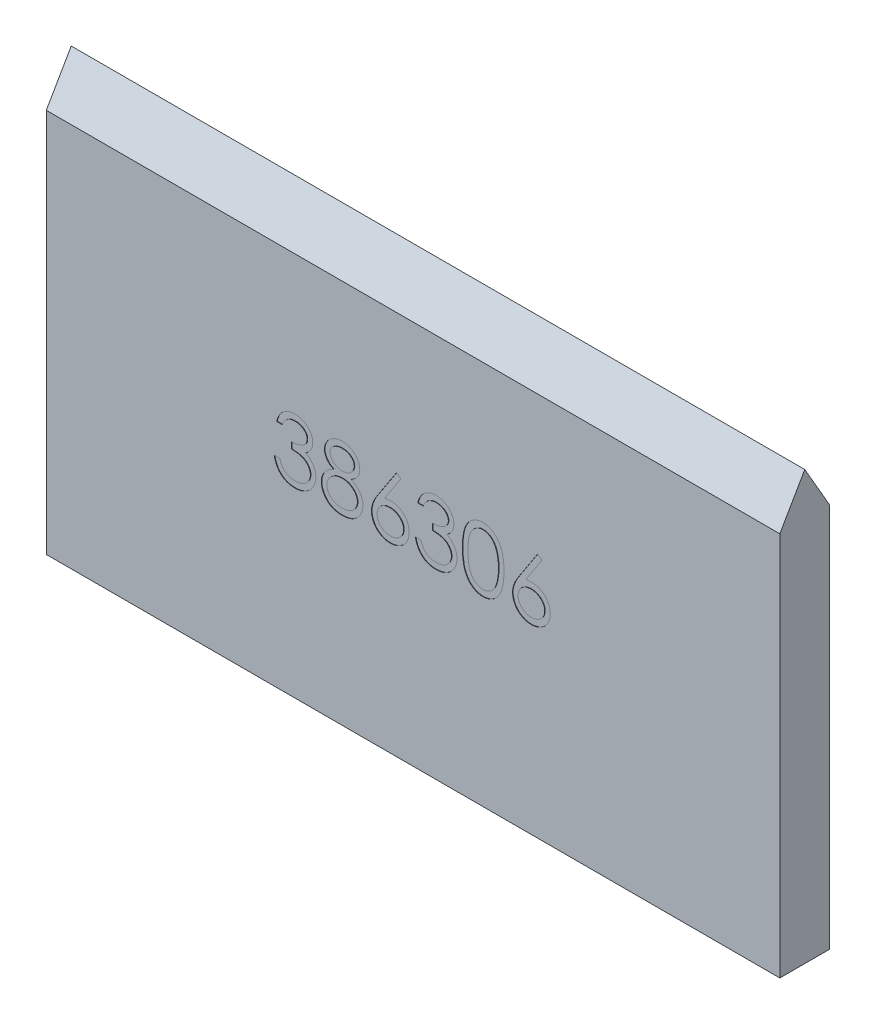
from build123d import *

# Parameters (mm, degrees)
CROQUIS1_W              = 38.1
CROQUIS1_H              = 22.225
SALIENTE_EXTRUIR1_DEPTH = 1.2954
CORTAR_EXTRUIR1_DEPTH   = 40.7086353
CORTAR_EXTRUIR2_DEPTH   = 0.0254


with BuildPart() as part:
    # Croquis1 → Saliente-Extruir1 (new, symmetric)
    with BuildSketch(Plane.XY):
        Rectangle(CROQUIS1_W, CROQUIS1_H)
    extrude(amount=SALIENTE_EXTRUIR1_DEPTH, both=True)

    # Croquis2 → Cortar-Extruir1 (cut, through all)
    with BuildSketch(Plane(origin=(19.05, 0, 0), x_dir=(0, 0, -1), z_dir=(1, 0, 0))):
        Polygon((-1.2954, 8.868801384), (0, 11.1125), (-1.2954, 11.1125), align=None)
    cortar_extruir1 = extrude(amount=-CORTAR_EXTRUIR1_DEPTH, mode=Mode.SUBTRACT)

    # Simetría1: Cortar-Extruir1 across plane
    add(cortar_extruir1.mirror(Plane.XY), mode=Mode.SUBTRACT)

    # Croquis3 → Cortar-Extruir2 (cut)
    # profile 1 of 6: a face of its own
    with BuildSketch(Plane.XY.offset(1.2954)):
        with BuildLine():
            Line((-6.79775641, 0.854807692), (-7.082692308, 0.854807692))
            add(Edge.make_bspline(
                [(-7.082692308, 0.854807692), (-7.07497293, 0.886768588), (-7.059882177, 0.949249526), (-7.028406521, 1.03851897), (-6.994117196, 1.122995307), (-6.952942794, 1.201096746), (-6.908031282, 1.274392893), (-6.85657567, 1.341221313), (-6.800949922, 1.403281646), (-6.739423003, 1.458357226), (-6.674899146, 1.50822988), (-6.60646917, 1.550752254), (-6.53550983, 1.587332021), (-6.461529488, 1.617467517), (-6.38430789, 1.640169242), (-6.30454316, 1.656640059), (-6.222026271, 1.667336284), (-6.166012385, 1.66838019), (-6.137570112, 1.668910256)],
                knots=[0, 0, 0, 0, 1.162005537, 2.271625781, 3.343758855, 4.383309926, 5.390229558, 6.379919256, 7.361854164, 8.333198761, 9.295911338, 10.242430842, 11.177959212, 12.116337295, 13.062827104, 14.020064771, 14.994644689, 16, 16, 16, 16], degree=3))
            add(Edge.make_bspline(
                [(-6.137570112, 1.668910256), (-6.096129339, 1.667659098), (-6.014151736, 1.665184071), (-5.893716686, 1.642583118), (-5.777578072, 1.606818891), (-5.667007112, 1.557403438), (-5.564301819, 1.496454947), (-5.472919707, 1.423915507), (-5.394099415, 1.341184712), (-5.327973801, 1.249805886), (-5.276198623, 1.15214696), (-5.23802027, 1.051635389), (-5.214777745, 0.9485096), (-5.211765526, 0.878879783), (-5.21025641, 0.843995393)],
                knots=[0, 0, 0, 0, 1.083050992, 2.142477498, 3.193116406, 4.255571735, 5.30263384, 6.308962982, 7.297363603, 8.282367274, 9.249857812, 10.179914175, 11.08814088, 12, 12, 12, 12], degree=3))
            add(Edge.make_bspline(
                [(-5.21025641, 0.843995393), (-5.211311954, 0.810424943), (-5.213377488, 0.744732783), (-5.230915921, 0.648828282), (-5.260430959, 0.558439116), (-5.301315673, 0.473184776), (-5.354239793, 0.393605814), (-5.418350025, 0.319523185), (-5.494098869, 0.250608306), (-5.551501905, 0.211129927), (-5.581054688, 0.190805288)],
                knots=[0, 0, 0, 0, 1.024540389, 2.004866551, 2.965041327, 3.920577974, 4.882998113, 5.874504559, 6.905732034, 8, 8, 8, 8], degree=3))
            add(Edge.make_bspline(
                [(-5.581054688, 0.190805288), (-5.547280167, 0.174496519), (-5.480363074, 0.142184128), (-5.38914938, 0.078814977), (-5.306347307, 0.005648148), (-5.260170362, -0.05144983), (-5.236969151, -0.080138221)],
                knots=[0, 0, 0, 0, 1.015518401, 2.012035669, 3.001164323, 4, 4, 4, 4], degree=3))
            add(Edge.make_bspline(
                [(-5.236969151, -0.080138221), (-5.221691647, -0.101054896), (-5.19138682, -0.14254572), (-5.1539803, -0.209253764), (-5.120044889, -0.276701186), (-5.093601476, -0.34669579), (-5.073123754, -0.41842631), (-5.058486068, -0.492015912), (-5.04939274, -0.567524689), (-5.048090489, -0.618608153), (-5.047435897, -0.644285857)],
                knots=[0, 0, 0, 0, 1.025084078, 2.033381695, 3.024893161, 4.013698104, 4.991890475, 5.976764909, 6.982997093, 8, 8, 8, 8], degree=3))
            add(Edge.make_bspline(
                [(-5.047435897, -0.644285857), (-5.049063778, -0.688744676), (-5.052311877, -0.777453089), (-5.081344144, -0.908512301), (-5.126350441, -1.036624006), (-5.190264947, -1.159156182), (-5.268159045, -1.273801242), (-5.360830332, -1.376377608), (-5.467225859, -1.464550628), (-5.585885269, -1.538219906), (-5.71444295, -1.597109735), (-5.851943666, -1.637983273), (-5.996406215, -1.664604287), (-6.095472835, -1.667458946), (-6.145838341, -1.668910256)],
                knots=[0, 0, 0, 0, 0.955779014, 1.907060117, 2.875433937, 3.871313158, 4.872415639, 5.851225146, 6.836215519, 7.83643374, 8.849228613, 9.86973379, 10.916971861, 12, 12, 12, 12], degree=3))
            add(Edge.make_bspline(
                [(-6.145838341, -1.668910256), (-6.179782992, -1.668122663), (-6.246574746, -1.666572942), (-6.344767063, -1.655978782), (-6.438494604, -1.63662942), (-6.527884097, -1.610591422), (-6.613014951, -1.577578913), (-6.693627389, -1.53646838), (-6.770217364, -1.488107231), (-6.842062127, -1.431924619), (-6.909153113, -1.369076547), (-6.96970737, -1.298447302), (-7.024734468, -1.221342514), (-7.072761005, -1.136866599), (-7.115974526, -1.046111259), (-7.151517251, -0.947914407), (-7.182800588, -0.843153901), (-7.197345231, -0.770149094), (-7.204807692, -0.732692308)],
                knots=[0, 0, 0, 0, 1.048658725, 2.063410685, 3.046034179, 4.001477787, 4.936774919, 5.862367409, 6.792675028, 7.730719943, 8.675894397, 9.627829632, 10.600096036, 11.597688215, 12.626045268, 13.701542398, 14.82072376, 16, 16, 16, 16], degree=3))
            Line((-7.204807692, -0.732692308), (-6.919871795, -0.732692308))
            add(Edge.make_bspline(
                [(-6.919871795, -0.732692308), (-6.91244838, -0.757138913), (-6.898009195, -0.804689683), (-6.873430796, -0.873124817), (-6.845428863, -0.935861051), (-6.815389228, -0.993358597), (-6.783840209, -1.046183705), (-6.748538813, -1.092939544), (-6.71209966, -1.135679763), (-6.68463196, -1.159759518), (-6.671188902, -1.171544471)],
                knots=[0, 0, 0, 0, 1.198163088, 2.33053128, 3.407730985, 4.417276592, 5.372219308, 6.28897303, 7.162600585, 8, 8, 8, 8], degree=3))
            add(Edge.make_bspline(
                [(-6.671188902, -1.171544471), (-6.653412008, -1.185249888), (-6.617913092, -1.212618417), (-6.560066197, -1.247544894), (-6.499228764, -1.27780811), (-6.434082596, -1.300925463), (-6.366033483, -1.320499484), (-6.293981515, -1.333308812), (-6.218562369, -1.342097367), (-6.167065897, -1.342872912), (-6.1407502, -1.343269231)],
                knots=[0, 0, 0, 0, 0.946170439, 1.889420265, 2.845303464, 3.807233317, 4.801018734, 5.828864929, 6.890507805, 8, 8, 8, 8], degree=3))
            add(Edge.make_bspline(
                [(-6.1407502, -1.343269231), (-6.111038094, -1.342710517), (-6.052938636, -1.341618), (-5.968161728, -1.331570751), (-5.887509972, -1.316938162), (-5.811878818, -1.294338528), (-5.740277572, -1.266415898), (-5.673709933, -1.231356273), (-5.611302036, -1.190222133), (-5.553853218, -1.143468753), (-5.502195508, -1.092286397), (-5.456711807, -1.038753111), (-5.41804515, -0.983094608), (-5.386854332, -0.925002884), (-5.362224904, -0.864718498), (-5.345458001, -0.802072274), (-5.333799841, -0.737576897), (-5.332850414, -0.693735618), (-5.332371795, -0.671634615)],
                knots=[0, 0, 0, 0, 1.217147791, 2.380027433, 3.494444702, 4.572153297, 5.609568379, 6.639424714, 7.649109417, 8.668170816, 9.669597737, 10.625200337, 11.543417969, 12.441394052, 13.322311151, 14.205496177, 15.095365482, 16, 16, 16, 16], degree=3))
            add(Edge.make_bspline(
                [(-5.332371795, -0.671634615), (-5.333759997, -0.642051472), (-5.336529494, -0.583032388), (-5.357673705, -0.496202874), (-5.392452532, -0.412543064), (-5.441141167, -0.333480312), (-5.500410007, -0.260205029), (-5.569683886, -0.194825899), (-5.649538065, -0.140878031), (-5.723034661, -0.103604749), (-5.78813591, -0.078171117), (-5.843848437, -0.061230256), (-5.906220499, -0.046885012), (-5.974497829, -0.03353888), (-6.04919489, -0.022180228), (-6.130230359, -0.012708009), (-6.217620657, -0.005128794), (-6.278119071, -0.001744157), (-6.309294872, 0)],
                knots=[0, 0, 0, 0, 1.07054697, 2.135767047, 3.216561865, 4.33974944, 5.486079747, 6.621378074, 7.775625952, 8.963672916, 9.598146892, 10.304877434, 11.070270905, 11.915000392, 12.823868403, 13.805723172, 14.86925407, 16, 16, 16, 16], degree=3))
            Line((-6.309294872, 0), (-6.309294872, 0.325641026))
            add(Edge.make_bspline(
                [(-6.309294872, 0.325641026), (-6.270014529, 0.326307598), (-6.193073986, 0.327613248), (-6.080684152, 0.343404801), (-5.973211933, 0.36524937), (-5.873039103, 0.398709509), (-5.781736342, 0.437571778), (-5.702524988, 0.482794854), (-5.63651479, 0.533063948), (-5.584026533, 0.589154958), (-5.544539304, 0.64931218), (-5.515667852, 0.712010862), (-5.49861327, 0.777800546), (-5.496336644, 0.82269928), (-5.495192308, 0.845267428)],
                knots=[0, 0, 0, 0, 1.321986639, 2.589447074, 3.816329219, 5.01088745, 6.139805852, 7.153945165, 8.075214402, 8.924034688, 9.728124013, 10.488707548, 11.240355623, 12, 12, 12, 12], degree=3))
            add(Edge.make_bspline(
                [(-5.495192308, 0.845267428), (-5.495568238, 0.861847954), (-5.496316132, 0.894834124), (-5.505747949, 0.94302615), (-5.519921186, 0.989744866), (-5.539406369, 1.034791594), (-5.565486906, 1.077853913), (-5.596698051, 1.119298956), (-5.633861971, 1.158890099), (-5.676448198, 1.19579296), (-5.722178906, 1.230962197), (-5.772298345, 1.260819567), (-5.825295332, 1.286351159), (-5.88122854, 1.307405493), (-5.940279485, 1.323243562), (-6.00217072, 1.334615361), (-6.067020261, 1.341725234), (-6.11126319, 1.342748868), (-6.133754006, 1.343269231)],
                knots=[0, 0, 0, 0, 0.884392785, 1.759457502, 2.611959086, 3.489218968, 4.37281399, 5.2945488, 6.255912374, 7.266815255, 8.301784654, 9.332968512, 10.37626691, 11.440494194, 12.520033166, 13.637162961, 14.798855837, 16, 16, 16, 16], degree=3))
            add(Edge.make_bspline(
                [(-6.133754006, 1.343269231), (-6.169905162, 1.342007067), (-6.240516778, 1.339541767), (-6.342311738, 1.317949033), (-6.436944277, 1.283497486), (-6.509278639, 1.242373961), (-6.562693546, 1.201778925), (-6.600863339, 1.166325617), (-6.638346945, 1.126925841), (-6.672678381, 1.081152887), (-6.707398345, 1.032106584), (-6.73900734, 0.977293673), (-6.769722918, 0.918143972), (-6.788230946, 0.876328647), (-6.79775641, 0.854807692)],
                knots=[0, 0, 0, 0, 1.472543308, 2.876219568, 4.221790263, 5.565193594, 6.249813518, 6.953379497, 7.687249741, 8.463570142, 9.283606569, 10.136032583, 11.040678096, 12, 12, 12, 12], degree=3))
        make_face()
    # profile 2 of 6: a face of its own
    with BuildSketch(Plane.XY.offset(1.2954)):
        with BuildLine():
            add(Edge.make_bspline(
                [(-3.218885216, 0.181265024), (-3.192896891, 0.167714164), (-3.142210979, 0.141285461), (-3.070023083, 0.098730639), (-3.004051117, 0.053880621), (-2.942464679, 0.008853806), (-2.886345782, -0.038074192), (-2.836321922, -0.087089984), (-2.791157438, -0.136970092), (-2.751763141, -0.188559161), (-2.717113154, -0.241720135), (-2.687166431, -0.296592547), (-2.661569397, -0.353056143), (-2.641283017, -0.411727267), (-2.62457182, -0.471744076), (-2.613073236, -0.533881531), (-2.606889317, -0.597730183), (-2.605720179, -0.640881428), (-2.605128205, -0.662730369)],
                knots=[0, 0, 0, 0, 1.272397273, 2.481599622, 3.635517121, 4.734568067, 5.792894095, 6.808321871, 7.773003508, 8.711915296, 9.623354172, 10.525449501, 11.423591555, 12.311487226, 13.218079475, 14.126165749, 15.051214107, 16, 16, 16, 16], degree=3))
            add(Edge.make_bspline(
                [(-2.605128205, -0.662730369), (-2.605827994, -0.693299026), (-2.607213138, -0.753805869), (-2.619278124, -0.843110556), (-2.63734204, -0.929844101), (-2.663721312, -1.013987489), (-2.697932745, -1.095076421), (-2.740093875, -1.173180308), (-2.787819753, -1.249579253), (-2.82614857, -1.296586853), (-2.845542869, -1.320372596)],
                knots=[0, 0, 0, 0, 1.025265484, 2.029385089, 3.018602448, 3.995076438, 4.983346944, 5.966715145, 6.97116228, 8, 8, 8, 8], degree=3))
            add(Edge.make_bspline(
                [(-2.845542869, -1.320372596), (-2.870794527, -1.34812552), (-2.920985803, -1.403288417), (-3.006967459, -1.47490808), (-3.101330168, -1.535096459), (-3.203708798, -1.584147392), (-3.313829683, -1.622325278), (-3.431669359, -1.649759562), (-3.557457555, -1.66547348), (-3.643913232, -1.667744957), (-3.688266226, -1.668910256)],
                knots=[0, 0, 0, 0, 0.954267603, 1.896743057, 2.838368354, 3.796610408, 4.779680527, 5.799409237, 6.871065594, 8, 8, 8, 8], degree=3))
            add(Edge.make_bspline(
                [(-3.688266226, -1.668910256), (-3.730914086, -1.667864794), (-3.813902489, -1.665830431), (-3.934695706, -1.652046911), (-4.047293062, -1.627891632), (-4.152349248, -1.594831165), (-4.24923092, -1.551823315), (-4.337662019, -1.498294258), (-4.418918408, -1.436398593), (-4.490534137, -1.364358679), (-4.554114369, -1.287199038), (-4.609965388, -1.207595792), (-4.656387588, -1.125541675), (-4.695691453, -1.042260185), (-4.725779588, -0.95658403), (-4.746618664, -0.868954019), (-4.759853256, -0.77952321), (-4.761614143, -0.719169496), (-4.7625, -0.688807091)],
                knots=[0, 0, 0, 0, 1.256902934, 2.445805442, 3.576955095, 4.645999104, 5.686449165, 6.692658513, 7.68621702, 8.689161843, 9.678783111, 10.630372946, 11.551080876, 12.453998257, 13.34127905, 14.221779781, 15.105423033, 16, 16, 16, 16], degree=3))
            add(Edge.make_bspline(
                [(-4.7625, -0.688807091), (-4.761975779, -0.666528396), (-4.760939734, -0.62249783), (-4.753768908, -0.557447225), (-4.742240518, -0.49413216), (-4.726583725, -0.432318771), (-4.705364722, -0.372457073), (-4.679745073, -0.314263429), (-4.649871087, -0.25767214), (-4.615326031, -0.202373726), (-4.575137766, -0.149143026), (-4.529632169, -0.097076659), (-4.477899746, -0.046982537), (-4.420516012, 0.001751377), (-4.358136751, 0.049989582), (-4.289141706, 0.095125136), (-4.215359906, 0.140353432), (-4.162922145, 0.167393842), (-4.136022636, 0.181265024)],
                knots=[0, 0, 0, 0, 0.941657376, 1.861047343, 2.762797495, 3.66048619, 4.553285746, 5.444104102, 6.34607688, 7.256116206, 8.197091036, 9.162375105, 10.176350973, 11.237807142, 12.343728897, 13.50695164, 14.721116704, 16, 16, 16, 16], degree=3))
            add(Edge.make_bspline(
                [(-4.136022636, 0.181265024), (-4.172844812, 0.201344421), (-4.24414285, 0.240223755), (-4.3385487, 0.311658357), (-4.419638766, 0.389026589), (-4.485184117, 0.473962189), (-4.536775352, 0.563811853), (-4.572170801, 0.658013425), (-4.596116183, 0.754820185), (-4.598488205, 0.820956521), (-4.599679487, 0.854171675)],
                knots=[0, 0, 0, 0, 1.166880483, 2.259407225, 3.286803203, 4.280235371, 5.237608625, 6.161067461, 7.076446754, 8, 8, 8, 8], degree=3))
            add(Edge.make_bspline(
                [(-4.599679487, 0.854171675), (-4.598195924, 0.888005888), (-4.595213703, 0.956018558), (-4.571098834, 1.057261256), (-4.531801345, 1.15669914), (-4.478351583, 1.253850251), (-4.411778894, 1.345426517), (-4.331908099, 1.42756009), (-4.240646537, 1.499506935), (-4.138449758, 1.559901034), (-4.028471172, 1.609053353), (-3.912433337, 1.642960922), (-3.792358018, 1.665127971), (-3.710626516, 1.667637722), (-3.669185697, 1.668910256)],
                knots=[0, 0, 0, 0, 0.888701115, 1.786444228, 2.72001202, 3.692817113, 4.693886446, 5.687152267, 6.695133018, 7.739871481, 8.800368666, 9.853104506, 10.91144658, 12, 12, 12, 12], degree=3))
            add(Edge.make_bspline(
                [(-3.669185697, 1.668910256), (-3.628814379, 1.667598217), (-3.54920674, 1.665011024), (-3.432190185, 1.643432927), (-3.320226189, 1.607392577), (-3.213700857, 1.558500096), (-3.114521235, 1.498277657), (-3.02688914, 1.425342578), (-2.949480298, 1.343571314), (-2.885450169, 1.252022817), (-2.832688119, 1.155245013), (-2.795948016, 1.05398744), (-2.772405868, 0.950437937), (-2.769436459, 0.880372033), (-2.767948718, 0.845267428)],
                knots=[0, 0, 0, 0, 1.072916533, 2.115669174, 3.151510826, 4.193348718, 5.225979165, 6.227137561, 7.216255879, 8.211077061, 9.189680878, 10.138522389, 11.067357538, 12, 12, 12, 12], degree=3))
            add(Edge.make_bspline(
                [(-2.767948718, 0.845267428), (-2.769250069, 0.810817169), (-2.77180585, 0.743158817), (-2.79330508, 0.644528331), (-2.829512158, 0.552161195), (-2.878946149, 0.465009303), (-2.943376412, 0.38465323), (-3.021942906, 0.310071147), (-3.114019247, 0.240650381), (-3.183198765, 0.201474179), (-3.218885216, 0.181265024)],
                knots=[0, 0, 0, 0, 0.975232327, 1.915300861, 2.843280834, 3.77672583, 4.742871857, 5.749627742, 6.839139064, 8, 8, 8, 8], degree=3))
        make_face()
        with BuildLine():
            add(Edge.make_bspline(
                [(-3.685086138, 1.343269231), (-3.707357226, 1.342678281), (-3.750929213, 1.341522125), (-3.814818078, 1.33548179), (-3.875571583, 1.323731372), (-3.933824488, 1.308093398), (-3.988778125, 1.286967866), (-4.041178828, 1.262116679), (-4.090134779, 1.23190332), (-4.136236961, 1.198011376), (-4.177739449, 1.16073424), (-4.214573578, 1.12189608), (-4.245169796, 1.080734118), (-4.271151374, 1.038272248), (-4.290003179, 0.993250226), (-4.304122226, 0.947048373), (-4.313666631, 0.899082846), (-4.314381813, 0.866301868), (-4.31474359, 0.849719551)],
                knots=[0, 0, 0, 0, 1.203892937, 2.355340988, 3.463153438, 4.544400666, 5.610487187, 6.640501085, 7.674077295, 8.714426146, 9.728707835, 10.68524104, 11.601827946, 12.495867327, 13.368432065, 14.231010473, 15.105153427, 16, 16, 16, 16], degree=3))
            add(Edge.make_bspline(
                [(-4.31474359, 0.849719551), (-4.31412005, 0.833136518), (-4.312887845, 0.800366061), (-4.303358193, 0.75197374), (-4.289155189, 0.704419826), (-4.266793518, 0.658835071), (-4.239972607, 0.613638167), (-4.206869625, 0.569958707), (-4.167418864, 0.527644679), (-4.122943972, 0.487055986), (-4.074492077, 0.449047822), (-4.023162266, 0.41605215), (-3.969598754, 0.388444064), (-3.914351877, 0.365466676), (-3.856858571, 0.34760509), (-3.797471127, 0.334933532), (-3.736179565, 0.327057721), (-3.694650038, 0.326116994), (-3.673637821, 0.325641026)],
                knots=[0, 0, 0, 0, 0.873023192, 1.725219244, 2.590779336, 3.480155217, 4.391973325, 5.357036234, 6.360879153, 7.436073238, 8.526419356, 9.601555421, 10.645666583, 11.697338044, 12.750135903, 13.812665442, 14.89329948, 16, 16, 16, 16], degree=3))
            add(Edge.make_bspline(
                [(-3.673637821, 0.325641026), (-3.646650226, 0.326432841), (-3.592941593, 0.328008651), (-3.513766771, 0.342660072), (-3.436784229, 0.365706869), (-3.362816794, 0.397239124), (-3.293779063, 0.436815826), (-3.23223843, 0.484198635), (-3.17871982, 0.538293466), (-3.133779409, 0.598258181), (-3.098936192, 0.662077122), (-3.07181098, 0.726121673), (-3.055971163, 0.791075126), (-3.053905085, 0.834588014), (-3.052884615, 0.856079728)],
                knots=[0, 0, 0, 0, 1.076279235, 2.141928126, 3.20205304, 4.278698113, 5.344010996, 6.36967002, 7.368914609, 8.37248503, 9.349703398, 10.264243087, 11.142681841, 12, 12, 12, 12], degree=3))
            add(Edge.make_bspline(
                [(-3.052884615, 0.856079728), (-3.053367122, 0.871163732), (-3.05432483, 0.901103317), (-3.062217024, 0.945315977), (-3.075257958, 0.988522814), (-3.092913752, 1.03108076), (-3.116145494, 1.072392709), (-3.14369015, 1.113108082), (-3.177149662, 1.152310953), (-3.214702141, 1.190914915), (-3.257288333, 1.226641851), (-3.304826168, 1.258060481), (-3.357071927, 1.28474169), (-3.414026846, 1.306412204), (-3.47548117, 1.322688478), (-3.541151849, 1.334877165), (-3.611586454, 1.341747059), (-3.660054871, 1.342750835), (-3.685086138, 1.343269231)],
                knots=[0, 0, 0, 0, 0.814439003, 1.616544685, 2.417341072, 3.248991801, 4.09997495, 4.973547432, 5.9003056, 6.880240646, 7.880314356, 8.896779544, 9.951930927, 11.043077905, 12.18215768, 13.381699519, 14.647792085, 16, 16, 16, 16], degree=3))
        make_face(mode=Mode.SUBTRACT)
        with BuildLine():
            add(Edge.make_bspline(
                [(-3.666641627, 0), (-3.694877161, -0.000502232), (-3.750268389, -0.001487488), (-3.831418602, -0.012454392), (-3.909299688, -0.027721056), (-3.983649059, -0.050881174), (-4.054435318, -0.080995133), (-4.122041666, -0.117221465), (-4.185950905, -0.160043546), (-4.245280521, -0.208917333), (-4.299458113, -0.261585552), (-4.346990856, -0.317340489), (-4.387356464, -0.375145929), (-4.419862342, -0.435736023), (-4.446542984, -0.497827784), (-4.46406343, -0.562967531), (-4.475295411, -0.629902984), (-4.476803656, -0.675405359), (-4.477564103, -0.698347356)],
                knots=[0, 0, 0, 0, 1.140299081, 2.23698856, 3.303958914, 4.344563908, 5.37730929, 6.408454204, 7.439741482, 8.480804886, 9.510774543, 10.48932336, 11.43758569, 12.353841022, 13.263987381, 14.161954604, 15.073269652, 16, 16, 16, 16], degree=3))
            add(Edge.make_bspline(
                [(-4.477564103, -0.698347356), (-4.476327432, -0.726859678), (-4.473873907, -0.783427458), (-4.45440967, -0.86703253), (-4.42317172, -0.947968773), (-4.379605988, -1.025576616), (-4.325660405, -1.098102783), (-4.259324252, -1.161320458), (-4.184720063, -1.217492085), (-4.099323581, -1.262922284), (-4.006043473, -1.299203331), (-3.904904547, -1.324200525), (-3.7973583, -1.340748126), (-3.723099955, -1.342415619), (-3.685086138, -1.343269231)],
                knots=[0, 0, 0, 0, 0.898778495, 1.783155532, 2.693654817, 3.627872908, 4.583023416, 5.533784346, 6.509005473, 7.520592997, 8.575161974, 9.658835044, 10.801527049, 12, 12, 12, 12], degree=3))
            add(Edge.make_bspline(
                [(-3.685086138, -1.343269231), (-3.655376875, -1.342698812), (-3.597493705, -1.341587452), (-3.513051452, -1.331777343), (-3.433363897, -1.316220183), (-3.358585573, -1.293592824), (-3.287879375, -1.265970345), (-3.222444118, -1.230435671), (-3.160596454, -1.190020349), (-3.105384, -1.14207045), (-3.055098161, -1.09083548), (-3.01125296, -1.036597369), (-2.973191467, -0.980830189), (-2.943318386, -0.922273678), (-2.919436713, -0.862051262), (-2.902270345, -0.79960762), (-2.89167835, -0.73475123), (-2.890607109, -0.690755644), (-2.890064103, -0.668454527)],
                knots=[0, 0, 0, 0, 1.224942928, 2.386581632, 3.501229538, 4.569074225, 5.605009692, 6.626002462, 7.634866581, 8.645888296, 9.63523824, 10.59253846, 11.518950513, 12.414518923, 13.29783783, 14.186679152, 15.080837789, 16, 16, 16, 16], degree=3))
            add(Edge.make_bspline(
                [(-2.890064103, -0.668454527), (-2.890885837, -0.646794368), (-2.892506153, -0.604084318), (-2.902790151, -0.540796112), (-2.920856697, -0.479652131), (-2.94564655, -0.419916768), (-2.97864928, -0.362800377), (-3.017515698, -0.306814993), (-3.064409648, -0.253514504), (-3.117398218, -0.20248491), (-3.175145989, -0.155299206), (-3.236529756, -0.113557537), (-3.301077018, -0.078403831), (-3.368651188, -0.049813867), (-3.439102221, -0.027328091), (-3.512378299, -0.01162001), (-3.588565213, -0.001732513), (-3.640322132, -0.000584029), (-3.666641627, 0)],
                knots=[0, 0, 0, 0, 0.917430815, 1.809013306, 2.70690318, 3.612392954, 4.541220862, 5.495268465, 6.494511384, 7.542276156, 8.608045339, 9.649016899, 10.681629292, 11.715607085, 12.752076957, 13.808767841, 14.885711793, 16, 16, 16, 16], degree=3))
        make_face(mode=Mode.SUBTRACT)
    # profile 3 of 6: a face of its own
    with BuildSketch(Plane.XY.offset(1.2954)):
        with BuildLine():
            Line((-0.854807692, 1.668910256), (-0.635381611, 1.496549479))
            Line((-0.635381611, 1.496549479), (-1.474288862, 0.213701923))
            add(Edge.make_bspline(
                [(-1.474288862, 0.213701923), (-1.418435825, 0.222604497), (-1.309488161, 0.239969973), (-1.199210525, 0.242834681), (-1.145467748, 0.244230769)],
                knots=[0, 0, 0, 0, 1.025318673, 2, 2, 2, 2], degree=3))
            add(Edge.make_bspline(
                [(-1.145467748, 0.244230769), (-1.113198412, 0.243363439), (-1.049677185, 0.241656126), (-0.956416729, 0.228517205), (-0.866801051, 0.207811567), (-0.781201588, 0.177628878), (-0.699311098, 0.139073171), (-0.620659638, 0.092864338), (-0.546725672, 0.036616328), (-0.476557102, -0.026216881), (-0.412851093, -0.095810146), (-0.356448528, -0.169652787), (-0.309071367, -0.247667872), (-0.270632167, -0.329815886), (-0.240782741, -0.4159702), (-0.21902252, -0.506020584), (-0.206159604, -0.600029133), (-0.204412909, -0.663962906), (-0.203525641, -0.696439303)],
                knots=[0, 0, 0, 0, 1.04369286, 2.054478336, 3.041073146, 4.015093852, 4.984733326, 5.965804835, 6.960378782, 7.985147595, 9.009457201, 10.008161701, 10.986880575, 11.956520048, 12.937015923, 13.931873656, 14.949455224, 16, 16, 16, 16], degree=3))
            add(Edge.make_bspline(
                [(-0.203525641, -0.696439303), (-0.2048166, -0.740870891), (-0.207356903, -0.828301743), (-0.232669632, -0.955643469), (-0.272003024, -1.076957965), (-0.328225497, -1.190308342), (-0.398059515, -1.295539245), (-0.483219903, -1.388780346), (-0.580686496, -1.471938165), (-0.690892377, -1.54147667), (-0.809494923, -1.59826658), (-0.934092807, -1.639056478), (-1.063476004, -1.66416934), (-1.151291612, -1.667317672), (-1.195713141, -1.668910256)],
                knots=[0, 0, 0, 0, 1.031375318, 2.029502543, 3.004789286, 3.987476834, 4.960371455, 5.9300674, 6.912260825, 7.929083631, 8.949397511, 9.960523116, 10.96833055, 12, 12, 12, 12], degree=3))
            add(Edge.make_bspline(
                [(-1.195713141, -1.668910256), (-1.238436577, -1.667523955), (-1.323064222, -1.664777936), (-1.447553971, -1.640315978), (-1.567172566, -1.600667392), (-1.681081933, -1.546044439), (-1.786601346, -1.477049074), (-1.881003744, -1.393989007), (-1.963818426, -1.298639706), (-2.03273826, -1.191015963), (-2.087401539, -1.075364358), (-2.128395256, -0.954771366), (-2.15234042, -0.829676383), (-2.155686468, -0.744875635), (-2.157371795, -0.702163462)],
                knots=[0, 0, 0, 0, 1.012016664, 2.004627821, 2.994792927, 3.992885782, 4.990978636, 5.973936114, 6.964471063, 7.975201453, 8.993600317, 9.990122807, 10.98767138, 12, 12, 12, 12], degree=3))
            add(Edge.make_bspline(
                [(-2.157371795, -0.702163462), (-2.156300055, -0.669465875), (-2.154111768, -0.602703652), (-2.138832407, -0.501589855), (-2.114280772, -0.398129231), (-2.086785048, -0.310359355), (-2.057733245, -0.238457832), (-2.033555584, -0.180488237), (-2.003462031, -0.120833549), (-1.97137332, -0.057448179), (-1.934401018, 0.008034321), (-1.894200393, 0.076708364), (-1.849659996, 0.147481769), (-1.818435991, 0.195509718), (-1.802473958, 0.220062099)],
                knots=[0, 0, 0, 0, 1.173818275, 2.396712641, 3.66331629, 4.989737886, 5.693666774, 6.447286557, 7.243889047, 8.091586357, 8.998013824, 9.943181721, 10.948533338, 12, 12, 12, 12], degree=3))
            Line((-1.802473958, 0.220062099), (-0.854807692, 1.668910256))
        make_face()
        with BuildLine():
            add(Edge.make_bspline(
                [(-1.205253405, -0.081410256), (-1.22943987, -0.082116053), (-1.276683063, -0.083494679), (-1.345995503, -0.091500444), (-1.411593953, -0.10657631), (-1.474347495, -0.125777197), (-1.533082911, -0.15217783), (-1.588227073, -0.184246962), (-1.639993227, -0.222003316), (-1.687839164, -0.264912), (-1.73121843, -0.311891144), (-1.768575598, -0.362209925), (-1.80079949, -0.414655666), (-1.826999426, -0.469666571), (-1.847401137, -0.52722161), (-1.862158765, -0.587056072), (-1.87037181, -0.649571192), (-1.871738178, -0.691964248), (-1.872435897, -0.713611779)],
                knots=[0, 0, 0, 0, 1.129588631, 2.206414736, 3.251139165, 4.268635594, 5.265702196, 6.250456724, 7.242448911, 8.251968645, 9.246821453, 10.222880186, 11.173611482, 12.116736599, 13.062300278, 14.020270554, 14.989073742, 16, 16, 16, 16], degree=3))
            add(Edge.make_bspline(
                [(-1.872435897, -0.713611779), (-1.871867698, -0.735065689), (-1.870753544, -0.777133613), (-1.860636796, -0.839127012), (-1.845183543, -0.898785179), (-1.822196184, -0.955800558), (-1.794776078, -1.011042218), (-1.758576249, -1.062509227), (-1.718465307, -1.113327433), (-1.670519239, -1.159593054), (-1.619063045, -1.202642991), (-1.564089097, -1.240271507), (-1.506793991, -1.272462536), (-1.446404201, -1.297691174), (-1.383776524, -1.318396063), (-1.318389164, -1.332966119), (-1.250196645, -1.341203454), (-1.204003173, -1.342571601), (-1.180448718, -1.343269231)],
                knots=[0, 0, 0, 0, 0.989467248, 1.94019797, 2.891935182, 3.827694429, 4.772920941, 5.730924762, 6.725747692, 7.756678648, 8.79901574, 9.819492441, 10.826891316, 11.826466727, 12.835195252, 13.867842842, 14.912794438, 16, 16, 16, 16], degree=3))
            add(Edge.make_bspline(
                [(-1.180448718, -1.343269231), (-1.156894301, -1.342571546), (-1.110700905, -1.341203292), (-1.042507837, -1.332966735), (-0.977122505, -1.318393804), (-0.914487458, -1.297699363), (-0.854124874, -1.27243216), (-0.796879877, -1.240471775), (-0.742425821, -1.202411583), (-0.690935848, -1.159666623), (-0.643189347, -1.113064107), (-0.602116387, -1.062962859), (-0.567025168, -1.010626254), (-0.53850987, -0.956018168), (-0.515775699, -0.898750704), (-0.500244082, -0.839136248), (-0.490148227, -0.777131196), (-0.489031202, -0.735064873), (-0.488461538, -0.713611779)],
                knots=[0, 0, 0, 0, 1.087397944, 2.132534446, 3.165364764, 4.174271784, 5.174024072, 6.181601208, 7.194203697, 8.236725232, 9.267838612, 10.269026844, 11.221737037, 12.171628256, 13.107553087, 14.05945871, 15.010357665, 16, 16, 16, 16], degree=3))
            add(Edge.make_bspline(
                [(-0.488461538, -0.713611779), (-0.488960733, -0.691936008), (-0.489940489, -0.649393518), (-0.5010221, -0.587084036), (-0.516391253, -0.526917599), (-0.539598717, -0.469272345), (-0.569749011, -0.414375754), (-0.606473244, -0.361950516), (-0.648957076, -0.311594701), (-0.698031272, -0.264819868), (-0.751453128, -0.222050733), (-0.808254409, -0.184295849), (-0.867679499, -0.152432478), (-0.929668147, -0.125846749), (-0.994930619, -0.106661155), (-1.062413284, -0.091554284), (-1.13297924, -0.083515168), (-1.180855163, -0.08212083), (-1.205253405, -0.081410256)],
                knots=[0, 0, 0, 0, 0.978206639, 1.919901502, 2.851605144, 3.780102724, 4.718870031, 5.675451981, 6.667674623, 7.690630536, 8.733308323, 9.756129687, 10.767539656, 11.776269907, 12.797430371, 13.836405707, 14.897401972, 16, 16, 16, 16], degree=3))
        make_face(mode=Mode.SUBTRACT)
    # profile 4 of 6: a face of its own
    with BuildSketch(Plane.XY.offset(1.2954)):
        with BuildLine():
            Line((0.529166667, 0.854807692), (0.244230769, 0.854807692))
            add(Edge.make_bspline(
                [(0.244230769, 0.854807692), (0.251950147, 0.886768588), (0.2670409, 0.949249526), (0.298516556, 1.03851897), (0.33280588, 1.122995307), (0.373980282, 1.201096746), (0.418891795, 1.274392893), (0.470347407, 1.341221313), (0.525973155, 1.403281646), (0.587500074, 1.458357226), (0.652023931, 1.50822988), (0.720453907, 1.550752254), (0.791413247, 1.587332021), (0.865393589, 1.617467517), (0.942615187, 1.640169242), (1.022379917, 1.656640059), (1.104896806, 1.667336284), (1.160910692, 1.66838019), (1.189352965, 1.668910256)],
                knots=[0, 0, 0, 0, 1.162005537, 2.271625781, 3.343758855, 4.383309926, 5.390229558, 6.379919256, 7.361854164, 8.333198761, 9.295911338, 10.242430842, 11.177959212, 12.116337295, 13.062827104, 14.020064771, 14.994644689, 16, 16, 16, 16], degree=3))
            add(Edge.make_bspline(
                [(1.189352965, 1.668910256), (1.230793738, 1.667659098), (1.312771341, 1.665184071), (1.43320639, 1.642583118), (1.549345005, 1.606818891), (1.659915965, 1.557403438), (1.762621258, 1.496454947), (1.85400337, 1.423915507), (1.932823662, 1.341184712), (1.998949276, 1.249805886), (2.050724454, 1.15214696), (2.088902807, 1.051635389), (2.112145332, 0.9485096), (2.115157551, 0.878879783), (2.116666667, 0.843995393)],
                knots=[0, 0, 0, 0, 1.083050992, 2.142477498, 3.193116406, 4.255571735, 5.30263384, 6.308962982, 7.297363603, 8.282367274, 9.249857812, 10.179914175, 11.08814088, 12, 12, 12, 12], degree=3))
            add(Edge.make_bspline(
                [(2.116666667, 0.843995393), (2.115611123, 0.810424943), (2.113545589, 0.744732783), (2.096007156, 0.648828282), (2.066492118, 0.558439116), (2.025607404, 0.473184776), (1.972683284, 0.393605814), (1.908573052, 0.319523185), (1.832824208, 0.250608306), (1.775421172, 0.211129927), (1.745868389, 0.190805288)],
                knots=[0, 0, 0, 0, 1.024540389, 2.004866551, 2.965041327, 3.920577974, 4.882998113, 5.874504559, 6.905732034, 8, 8, 8, 8], degree=3))
            add(Edge.make_bspline(
                [(1.745868389, 0.190805288), (1.77964291, 0.174496519), (1.846560003, 0.142184128), (1.937773697, 0.078814977), (2.02057577, 0.005648148), (2.066752715, -0.05144983), (2.089953926, -0.080138221)],
                knots=[0, 0, 0, 0, 1.015518401, 2.012035669, 3.001164323, 4, 4, 4, 4], degree=3))
            add(Edge.make_bspline(
                [(2.089953926, -0.080138221), (2.10523143, -0.101054896), (2.135536257, -0.14254572), (2.172942777, -0.209253764), (2.206878188, -0.276701186), (2.233321601, -0.34669579), (2.253799323, -0.41842631), (2.268437009, -0.492015912), (2.277530337, -0.567524689), (2.278832588, -0.618608153), (2.279487179, -0.644285857)],
                knots=[0, 0, 0, 0, 1.025084078, 2.033381695, 3.024893161, 4.013698104, 4.991890475, 5.976764909, 6.982997093, 8, 8, 8, 8], degree=3))
            add(Edge.make_bspline(
                [(2.279487179, -0.644285857), (2.277859299, -0.688744676), (2.2746112, -0.777453089), (2.245578933, -0.908512301), (2.200572636, -1.036624006), (2.136658129, -1.159156182), (2.058764032, -1.273801242), (1.966092745, -1.376377608), (1.859697218, -1.464550628), (1.741037808, -1.538219906), (1.612480127, -1.597109735), (1.474979411, -1.637983273), (1.330516862, -1.664604287), (1.231450242, -1.667458946), (1.181084736, -1.668910256)],
                knots=[0, 0, 0, 0, 0.955779014, 1.907060117, 2.875433937, 3.871313158, 4.872415639, 5.851225146, 6.836215519, 7.83643374, 8.849228613, 9.86973379, 10.916971861, 12, 12, 12, 12], degree=3))
            add(Edge.make_bspline(
                [(1.181084736, -1.668910256), (1.147140085, -1.668122663), (1.080348331, -1.666572942), (0.982156014, -1.655978782), (0.888428473, -1.63662942), (0.79903898, -1.610591422), (0.713908126, -1.577578913), (0.633295688, -1.53646838), (0.556705713, -1.488107231), (0.48486095, -1.431924619), (0.417769964, -1.369076547), (0.357215707, -1.298447302), (0.302188609, -1.221342514), (0.254162072, -1.136866599), (0.210948551, -1.046111259), (0.175405826, -0.947914407), (0.144122489, -0.843153901), (0.129577846, -0.770149094), (0.122115385, -0.732692308)],
                knots=[0, 0, 0, 0, 1.048658725, 2.063410685, 3.046034179, 4.001477787, 4.936774919, 5.862367409, 6.792675028, 7.730719943, 8.675894397, 9.627829632, 10.600096036, 11.597688215, 12.626045268, 13.701542398, 14.82072376, 16, 16, 16, 16], degree=3))
            Line((0.122115385, -0.732692308), (0.407051282, -0.732692308))
            add(Edge.make_bspline(
                [(0.407051282, -0.732692308), (0.414474696, -0.757138913), (0.428913882, -0.804689683), (0.453492281, -0.873124817), (0.481494214, -0.935861051), (0.511533849, -0.993358597), (0.543082868, -1.046183705), (0.578384264, -1.092939544), (0.614823417, -1.135679763), (0.642291116, -1.159759518), (0.655734175, -1.171544471)],
                knots=[0, 0, 0, 0, 1.198163088, 2.33053128, 3.407730985, 4.417276592, 5.372219308, 6.28897303, 7.162600585, 8, 8, 8, 8], degree=3))
            add(Edge.make_bspline(
                [(0.655734175, -1.171544471), (0.673511069, -1.185249888), (0.709009985, -1.212618417), (0.76685688, -1.247544894), (0.827694312, -1.27780811), (0.892840481, -1.300925463), (0.960889594, -1.320499484), (1.032941561, -1.333308812), (1.108360708, -1.342097367), (1.15985718, -1.342872912), (1.186172877, -1.343269231)],
                knots=[0, 0, 0, 0, 0.946170439, 1.889420265, 2.845303464, 3.807233317, 4.801018734, 5.828864929, 6.890507805, 8, 8, 8, 8], degree=3))
            add(Edge.make_bspline(
                [(1.186172877, -1.343269231), (1.215884983, -1.342710517), (1.273984441, -1.341618), (1.358761349, -1.331570751), (1.439413105, -1.316938162), (1.515044259, -1.294338528), (1.586645505, -1.266415898), (1.653213144, -1.231356273), (1.715621041, -1.190222133), (1.773069858, -1.143468753), (1.824727569, -1.092286397), (1.87021127, -1.038753111), (1.908877927, -0.983094608), (1.940068745, -0.925002884), (1.964698172, -0.864718498), (1.981465076, -0.802072274), (1.993123236, -0.737576897), (1.994072663, -0.693735618), (1.994551282, -0.671634615)],
                knots=[0, 0, 0, 0, 1.217147791, 2.380027433, 3.494444702, 4.572153297, 5.609568379, 6.639424714, 7.649109417, 8.668170816, 9.669597737, 10.625200337, 11.543417969, 12.441394052, 13.322311151, 14.205496177, 15.095365482, 16, 16, 16, 16], degree=3))
            add(Edge.make_bspline(
                [(1.994551282, -0.671634615), (1.99316308, -0.642051472), (1.990393583, -0.583032388), (1.969249372, -0.496202874), (1.934470545, -0.412543064), (1.88578191, -0.333480312), (1.82651307, -0.260205029), (1.75723919, -0.194825899), (1.677385012, -0.140878031), (1.603888416, -0.103604749), (1.538787167, -0.078171117), (1.48307464, -0.061230256), (1.420702578, -0.046885012), (1.352425248, -0.03353888), (1.277728187, -0.022180228), (1.196692718, -0.012708009), (1.10930242, -0.005128794), (1.048804005, -0.001744157), (1.017628205, 0)],
                knots=[0, 0, 0, 0, 1.07054697, 2.135767047, 3.216561865, 4.33974944, 5.486079747, 6.621378074, 7.775625952, 8.963672916, 9.598146892, 10.304877434, 11.070270905, 11.915000392, 12.823868403, 13.805723172, 14.86925407, 16, 16, 16, 16], degree=3))
            Line((1.017628205, 0), (1.017628205, 0.325641026))
            add(Edge.make_bspline(
                [(1.017628205, 0.325641026), (1.056908548, 0.326307598), (1.133849091, 0.327613248), (1.246238925, 0.343404801), (1.353711144, 0.36524937), (1.453883974, 0.398709509), (1.545186735, 0.437571778), (1.624398089, 0.482794854), (1.690408287, 0.533063948), (1.742896544, 0.589154958), (1.782383773, 0.64931218), (1.811255225, 0.712010862), (1.828309807, 0.777800546), (1.830586433, 0.82269928), (1.831730769, 0.845267428)],
                knots=[0, 0, 0, 0, 1.321986639, 2.589447074, 3.816329219, 5.01088745, 6.139805852, 7.153945165, 8.075214402, 8.924034688, 9.728124013, 10.488707548, 11.240355623, 12, 12, 12, 12], degree=3))
            add(Edge.make_bspline(
                [(1.831730769, 0.845267428), (1.831354839, 0.861847954), (1.830606944, 0.894834124), (1.821175128, 0.94302615), (1.807001891, 0.989744866), (1.787516708, 1.034791594), (1.761436171, 1.077853913), (1.730225026, 1.119298956), (1.693061106, 1.158890099), (1.650474879, 1.19579296), (1.60474417, 1.230962197), (1.554624732, 1.260819567), (1.501627745, 1.286351159), (1.445694537, 1.307405493), (1.386643592, 1.323243562), (1.324752357, 1.334615361), (1.259902816, 1.341725234), (1.215659887, 1.342748868), (1.193169071, 1.343269231)],
                knots=[0, 0, 0, 0, 0.884392785, 1.759457502, 2.611959086, 3.489218968, 4.37281399, 5.2945488, 6.255912374, 7.266815255, 8.301784654, 9.332968512, 10.37626691, 11.440494194, 12.520033166, 13.637162961, 14.798855837, 16, 16, 16, 16], degree=3))
            add(Edge.make_bspline(
                [(1.193169071, 1.343269231), (1.157017915, 1.342007067), (1.086406299, 1.339541767), (0.984611338, 1.317949033), (0.8899788, 1.283497486), (0.817644438, 1.242373961), (0.764229531, 1.201778925), (0.726059737, 1.166325617), (0.688576132, 1.126925841), (0.654244696, 1.081152887), (0.619524732, 1.032106584), (0.587915736, 0.977293673), (0.557200159, 0.918143972), (0.538692131, 0.876328647), (0.529166667, 0.854807692)],
                knots=[0, 0, 0, 0, 1.472543308, 2.876219568, 4.221790263, 5.565193594, 6.249813518, 6.953379497, 7.687249741, 8.463570142, 9.283606569, 10.136032583, 11.040678096, 12, 12, 12, 12], degree=3))
        make_face()
    # profile 5 of 6: a face of its own
    with BuildSketch(Plane.XY.offset(1.2954)):
        with BuildLine():
            add(Edge.make_bspline(
                [(2.564423077, -0.001272035), (2.564720636, 0.049616309), (2.56529865, 0.148467652), (2.57172886, 0.292508006), (2.582410778, 0.427636268), (2.59704968, 0.553858907), (2.614864134, 0.671208507), (2.638645325, 0.779371466), (2.665689796, 0.878848394), (2.6970338, 0.969963681), (2.732401295, 1.053944883), (2.770895231, 1.132344887), (2.814043295, 1.205045069), (2.859379494, 1.273205779), (2.908739016, 1.335711273), (2.960717205, 1.39344426), (3.017342764, 1.445070441), (3.076690779, 1.492102444), (3.139298571, 1.533331607), (3.203381561, 1.56964702), (3.269380836, 1.600671185), (3.337476588, 1.625064652), (3.407056765, 1.645213063), (3.478364604, 1.658991609), (3.551517842, 1.66766109), (3.600894929, 1.668489917), (3.625936498, 1.668910256)],
                knots=[0, 0, 0, 0, 1.646270934, 3.197905019, 4.663502075, 6.030701355, 7.308322542, 8.50163776, 9.611534131, 10.641858119, 11.616356847, 12.558055219, 13.465016945, 14.349605745, 15.204443733, 16.039544428, 16.859896111, 17.680448484, 18.487036065, 19.28249412, 20.06191084, 20.843045899, 21.620316918, 22.403196591, 23.190181807, 24, 24, 24, 24], degree=3))
            add(Edge.make_bspline(
                [(3.625936498, 1.668910256), (3.651187254, 1.668467738), (3.701403062, 1.667587709), (3.775643974, 1.659129561), (3.848169756, 1.645095043), (3.918671211, 1.625209587), (3.987727449, 1.600539223), (4.054798333, 1.569617338), (4.120300471, 1.533622937), (4.183192946, 1.49132842), (4.244166204, 1.444173069), (4.301722571, 1.390866934), (4.355867284, 1.33194826), (4.407279883, 1.268047427), (4.454501746, 1.197938814), (4.499471931, 1.1228418), (4.539723706, 1.041443087), (4.578490162, 0.955100805), (4.611951928, 0.861425915), (4.642129165, 0.760946454), (4.666512229, 0.652475584), (4.686822498, 0.536582419), (4.702556796, 0.412841345), (4.714016407, 0.281517616), (4.720069849, 0.142524833), (4.721209856, 0.047494498), (4.721794872, -0.001272035)],
                knots=[0, 0, 0, 0, 0.810914788, 1.612654377, 2.396697861, 3.181598691, 3.963628158, 4.749916497, 5.551656086, 6.361998678, 7.18212741, 8.025565596, 8.878627764, 9.750805457, 10.657531673, 11.591944965, 12.560506719, 13.57287815, 14.630710178, 15.753379473, 16.941251878, 18.199788006, 19.531962791, 20.947069417, 22.433333509, 24, 24, 24, 24], degree=3))
            add(Edge.make_bspline(
                [(4.721794872, -0.001272035), (4.721203792, -0.049825866), (4.720052096, -0.144431025), (4.714084269, -0.28279841), (4.702328939, -0.413425206), (4.687624164, -0.536624697), (4.667257933, -0.651884109), (4.642216104, -0.759602287), (4.614411883, -0.860244409), (4.580090319, -0.952985988), (4.542524889, -1.039120765), (4.50165339, -1.119554536), (4.457865762, -1.194998244), (4.410160258, -1.264848014), (4.359311804, -1.329598653), (4.304232096, -1.388107211), (4.246473779, -1.441783463), (4.185321088, -1.489546011), (4.121447752, -1.531351513), (4.056170589, -1.568738363), (3.988331377, -1.598885165), (3.919467484, -1.624770523), (3.848593895, -1.644546647), (3.775798955, -1.658220788), (3.701452941, -1.667810965), (3.651195807, -1.668542557), (3.625936498, -1.668910256)],
                knots=[0, 0, 0, 0, 1.561518951, 3.042555995, 4.452378317, 5.7783523, 7.031515105, 8.214008947, 9.334062868, 10.386615937, 11.391082383, 12.354592575, 13.286541444, 14.194233754, 15.072674879, 15.931287219, 16.775624067, 17.606195743, 18.42308326, 19.229000347, 20.022332153, 20.807536673, 21.593273796, 22.3848459, 23.188221202, 24, 24, 24, 24], degree=3))
            add(Edge.make_bspline(
                [(3.625936498, -1.668910256), (3.600895624, -1.668487205), (3.551519906, -1.667653031), (3.478356634, -1.659022718), (3.407343275, -1.645147511), (3.338129405, -1.625719592), (3.270359924, -1.60193899), (3.204958292, -1.57095672), (3.141197322, -1.535275101), (3.079247125, -1.494639254), (3.020271807, -1.448083156), (2.963939501, -1.396589837), (2.911665377, -1.338874314), (2.86301159, -1.275847912), (2.81677081, -1.208090471), (2.77423545, -1.134676875), (2.734891889, -1.055898221), (2.69892958, -0.971245545), (2.667044721, -0.879483575), (2.638880014, -0.779562534), (2.616642171, -0.670600493), (2.597607633, -0.553472596), (2.5822548, -0.42767553), (2.571773376, -0.293141003), (2.565295184, -0.149952849), (2.564719084, -0.051736697), (2.564423077, -0.001272035)],
                knots=[0, 0, 0, 0, 0.810891512, 1.598919785, 2.382837074, 3.152667961, 3.926044502, 4.706494248, 5.493654104, 6.291793342, 7.103789334, 7.925228297, 8.761435821, 9.622817696, 10.50288917, 11.416980706, 12.369136599, 13.353924996, 14.394355917, 15.514179734, 16.714354668, 17.994756427, 19.357759367, 20.818452758, 22.365282078, 24, 24, 24, 24], degree=3))
        make_face()
        with BuildLine():
            add(Edge.make_bspline(
                [(2.849358974, 0), (2.84946733, -0.042407748), (2.849677627, -0.12471286), (2.855171466, -0.244313533), (2.862655605, -0.355865188), (2.872308782, -0.459509468), (2.886644313, -0.55489555), (2.9027069, -0.642679477), (2.922254095, -0.722396685), (2.945381719, -0.794594199), (2.971724328, -0.860497283), (3.000486076, -0.921821242), (3.031384017, -0.979290499), (3.065963532, -1.032388844), (3.103623625, -1.081289435), (3.143513653, -1.12685779), (3.187122355, -1.167495052), (3.24745075, -1.216232985), (3.327094694, -1.26659677), (3.42744325, -1.31045358), (3.530556774, -1.338014809), (3.600543979, -1.341519787), (3.635476763, -1.343269231)],
                knots=[0, 0, 0, 0, 1.459021318, 2.831673884, 4.118529203, 5.306027144, 6.411944654, 7.436330062, 8.375795394, 9.233974572, 10.042671642, 10.816086306, 11.563610507, 12.285937304, 12.993564865, 13.685989202, 14.367179055, 15.041617293, 16.353048772, 17.594441528, 18.799311195, 20, 20, 20, 20], degree=3))
            add(Edge.make_bspline(
                [(3.635476763, -1.343269231), (3.670635508, -1.341819815), (3.740880408, -1.338923977), (3.843508922, -1.310985122), (3.943140667, -1.268830612), (4.021220213, -1.218985374), (4.080622235, -1.171516104), (4.123182647, -1.131044245), (4.162246077, -1.085727136), (4.199295673, -1.036832775), (4.233276406, -0.983427022), (4.264176538, -0.925766685), (4.292373575, -0.863691646), (4.30843821, -0.820357668), (4.316651643, -0.798202123)],
                knots=[0, 0, 0, 0, 1.353760809, 2.704726607, 4.075137775, 5.516104923, 6.260822281, 7.007110065, 7.778089737, 8.566572457, 9.372053459, 10.217411131, 11.088608312, 12, 12, 12, 12], degree=3))
            add(Edge.make_bspline(
                [(4.316651643, -0.798202123), (4.326223603, -0.769872288), (4.345658789, -0.712350574), (4.370706613, -0.623120689), (4.390432796, -0.529501039), (4.408179564, -0.432051112), (4.420292693, -0.33005224), (4.430042495, -0.22382002), (4.435785332, -0.113274356), (4.436497214, -0.038167471), (4.436858974, 0)],
                knots=[0, 0, 0, 0, 0.884706709, 1.796334032, 2.740027952, 3.714592787, 4.726048262, 5.777819803, 6.87074269, 8, 8, 8, 8], degree=3))
            add(Edge.make_bspline(
                [(4.436858974, 0), (4.436359874, 0.038161298), (4.435383527, 0.112812955), (4.431651553, 0.222140161), (4.422014453, 0.325978773), (4.411310967, 0.42477613), (4.395529202, 0.517985333), (4.378513191, 0.606386682), (4.355652092, 0.688884997), (4.33123201, 0.766771903), (4.30328258, 0.839162497), (4.272516164, 0.906394289), (4.239657854, 0.968791861), (4.203968822, 1.026184015), (4.165872738, 1.078827822), (4.124364104, 1.125667775), (4.081089423, 1.168155596), (4.02047669, 1.216653784), (3.941125013, 1.266103679), (3.842386461, 1.31161119), (3.739633805, 1.337744427), (3.670170743, 1.341428957), (3.635476763, 1.343269231)],
                knots=[0, 0, 0, 0, 1.31362396, 2.569729283, 3.763502607, 4.902122613, 5.988968491, 7.01645872, 7.998833611, 8.933434873, 9.825090667, 10.667526885, 11.477055099, 12.250526234, 12.991942729, 13.710640831, 14.402115721, 15.076753259, 16.378508321, 17.609869233, 18.806226677, 20, 20, 20, 20], degree=3))
            add(Edge.make_bspline(
                [(3.635476763, 1.343269231), (3.600360726, 1.341426418), (3.530064678, 1.337737437), (3.426244034, 1.311708557), (3.326726515, 1.266339652), (3.247584674, 1.21649), (3.186929667, 1.169011674), (3.144218938, 1.127839677), (3.104172053, 1.082803432), (3.06728064, 1.033453123), (3.032728219, 0.980416683), (3.000995443, 0.923276875), (2.972404722, 0.861744137), (2.946020893, 0.795870657), (2.922822721, 0.723679371), (2.903687483, 0.644060356), (2.886009942, 0.556555639), (2.873495662, 0.460652943), (2.862370684, 0.356982704), (2.855221175, 0.245152565), (2.849659249, 0.125351306), (2.849461071, 0.042620641), (2.849358974, 0)],
                knots=[0, 0, 0, 0, 1.207732386, 2.417664972, 3.655092373, 4.956220595, 5.625982001, 6.301752483, 6.994047911, 7.697131622, 8.419323945, 9.170223765, 9.943494443, 10.752040957, 11.610060368, 12.549350801, 13.567764191, 14.679664412, 15.874934091, 17.154273443, 18.533957287, 20, 20, 20, 20], degree=3))
        make_face(mode=Mode.SUBTRACT)
    # profile 6 of 6: a face of its own
    with BuildSketch(Plane.XY.offset(1.2954)):
        with BuildLine():
            Line((6.472115385, 1.668910256), (6.691541466, 1.496549479))
            Line((6.691541466, 1.496549479), (5.852634215, 0.213701923))
            add(Edge.make_bspline(
                [(5.852634215, 0.213701923), (5.908487252, 0.222604497), (6.017434915, 0.239969973), (6.127712552, 0.242834681), (6.181455329, 0.244230769)],
                knots=[0, 0, 0, 0, 1.025318673, 2, 2, 2, 2], degree=3))
            add(Edge.make_bspline(
                [(6.181455329, 0.244230769), (6.213724664, 0.243363439), (6.277245892, 0.241656126), (6.370506348, 0.228517205), (6.460122026, 0.207811567), (6.545721488, 0.177628878), (6.627611979, 0.139073171), (6.706263438, 0.092864338), (6.780197405, 0.036616328), (6.850365975, -0.026216881), (6.914071984, -0.095810146), (6.970474549, -0.169652787), (7.01785171, -0.247667872), (7.05629091, -0.329815886), (7.086140336, -0.4159702), (7.107900557, -0.506020584), (7.120763473, -0.600029133), (7.122510168, -0.663962906), (7.123397436, -0.696439303)],
                knots=[0, 0, 0, 0, 1.04369286, 2.054478336, 3.041073146, 4.015093852, 4.984733326, 5.965804835, 6.960378782, 7.985147595, 9.009457201, 10.008161701, 10.986880575, 11.956520048, 12.937015923, 13.931873656, 14.949455224, 16, 16, 16, 16], degree=3))
            add(Edge.make_bspline(
                [(7.123397436, -0.696439303), (7.122106476, -0.740870891), (7.119566174, -0.828301743), (7.094253445, -0.955643469), (7.054920053, -1.076957965), (6.99869758, -1.190308342), (6.928863562, -1.295539245), (6.843703174, -1.388780346), (6.746236581, -1.471938165), (6.6360307, -1.54147667), (6.517428154, -1.59826658), (6.39283027, -1.639056478), (6.263447073, -1.66416934), (6.175631465, -1.667317672), (6.131209936, -1.668910256)],
                knots=[0, 0, 0, 0, 1.031375318, 2.029502543, 3.004789286, 3.987476834, 4.960371455, 5.9300674, 6.912260825, 7.929083631, 8.949397511, 9.960523116, 10.96833055, 12, 12, 12, 12], degree=3))
            add(Edge.make_bspline(
                [(6.131209936, -1.668910256), (6.0884865, -1.667523955), (6.003858855, -1.664777936), (5.879369106, -1.640315978), (5.759750511, -1.600667392), (5.645841144, -1.546044439), (5.540321731, -1.477049074), (5.445919332, -1.393989007), (5.363104651, -1.298639706), (5.294184817, -1.191015963), (5.239521538, -1.075364358), (5.19852782, -0.954771366), (5.174582657, -0.829676383), (5.171236609, -0.744875635), (5.169551282, -0.702163462)],
                knots=[0, 0, 0, 0, 1.012016664, 2.004627821, 2.994792927, 3.992885782, 4.990978636, 5.973936114, 6.964471063, 7.975201453, 8.993600317, 9.990122807, 10.98767138, 12, 12, 12, 12], degree=3))
            add(Edge.make_bspline(
                [(5.169551282, -0.702163462), (5.170623021, -0.669465875), (5.172811309, -0.602703652), (5.18809067, -0.501589855), (5.212642305, -0.398129231), (5.240138029, -0.310359355), (5.269189832, -0.238457832), (5.293367493, -0.180488237), (5.323461046, -0.120833549), (5.355549756, -0.057448179), (5.392522059, 0.008034321), (5.432722684, 0.076708364), (5.477263081, 0.147481769), (5.508487086, 0.195509718), (5.524449119, 0.220062099)],
                knots=[0, 0, 0, 0, 1.173818275, 2.396712641, 3.66331629, 4.989737886, 5.693666774, 6.447286557, 7.243889047, 8.091586357, 8.998013824, 9.943181721, 10.948533338, 12, 12, 12, 12], degree=3))
            Line((5.524449119, 0.220062099), (6.472115385, 1.668910256))
        make_face()
        with BuildLine():
            add(Edge.make_bspline(
                [(6.121669671, -0.081410256), (6.097483207, -0.082116053), (6.050240014, -0.083494679), (5.980927574, -0.091500444), (5.915329124, -0.10657631), (5.852575582, -0.125777197), (5.793840166, -0.15217783), (5.738696004, -0.184246962), (5.686929849, -0.222003316), (5.639083913, -0.264912), (5.595704647, -0.311891144), (5.558347479, -0.362209925), (5.526123587, -0.414655666), (5.499923651, -0.469666571), (5.47952194, -0.52722161), (5.464764312, -0.587056072), (5.456551266, -0.649571192), (5.455184899, -0.691964248), (5.454487179, -0.713611779)],
                knots=[0, 0, 0, 0, 1.129588631, 2.206414736, 3.251139165, 4.268635594, 5.265702196, 6.250456724, 7.242448911, 8.251968645, 9.246821453, 10.222880186, 11.173611482, 12.116736599, 13.062300278, 14.020270554, 14.989073742, 16, 16, 16, 16], degree=3))
            add(Edge.make_bspline(
                [(5.454487179, -0.713611779), (5.455055379, -0.735065689), (5.456169533, -0.777133613), (5.46628628, -0.839127012), (5.481739534, -0.898785179), (5.504726893, -0.955800558), (5.532146999, -1.011042218), (5.568346828, -1.062509227), (5.60845777, -1.113327433), (5.656403838, -1.159593054), (5.707860031, -1.202642991), (5.762833979, -1.240271507), (5.820129086, -1.272462536), (5.880518876, -1.297691174), (5.943146553, -1.318396063), (6.008533913, -1.332966119), (6.076726432, -1.341203454), (6.122919904, -1.342571601), (6.146474359, -1.343269231)],
                knots=[0, 0, 0, 0, 0.989467248, 1.94019797, 2.891935182, 3.827694429, 4.772920941, 5.730924762, 6.725747692, 7.756678648, 8.79901574, 9.819492441, 10.826891316, 11.826466727, 12.835195252, 13.867842842, 14.912794438, 16, 16, 16, 16], degree=3))
            add(Edge.make_bspline(
                [(6.146474359, -1.343269231), (6.170028775, -1.342571546), (6.216222172, -1.341203292), (6.28441524, -1.332966735), (6.349800572, -1.318393804), (6.412435619, -1.297699363), (6.472798203, -1.27243216), (6.5300432, -1.240471775), (6.584497256, -1.202411583), (6.635987229, -1.159666623), (6.68373373, -1.113064107), (6.72480669, -1.062962859), (6.759897909, -1.010626254), (6.788413207, -0.956018168), (6.811147378, -0.898750704), (6.826678995, -0.839136248), (6.83677485, -0.777131196), (6.837891875, -0.735064873), (6.838461538, -0.713611779)],
                knots=[0, 0, 0, 0, 1.087397944, 2.132534446, 3.165364764, 4.174271784, 5.174024072, 6.181601208, 7.194203697, 8.236725232, 9.267838612, 10.269026844, 11.221737037, 12.171628256, 13.107553087, 14.05945871, 15.010357665, 16, 16, 16, 16], degree=3))
            add(Edge.make_bspline(
                [(6.838461538, -0.713611779), (6.837962344, -0.691936008), (6.836982588, -0.649393518), (6.825900977, -0.587084036), (6.810531824, -0.526917599), (6.78732436, -0.469272345), (6.757174066, -0.414375754), (6.720449833, -0.361950516), (6.677966001, -0.311594701), (6.628891804, -0.264819868), (6.575469949, -0.222050733), (6.518668668, -0.184295849), (6.459243578, -0.152432478), (6.39725493, -0.125846749), (6.331992458, -0.106661155), (6.264509793, -0.091554284), (6.193943837, -0.083515168), (6.146067914, -0.08212083), (6.121669671, -0.081410256)],
                knots=[0, 0, 0, 0, 0.978206639, 1.919901502, 2.851605144, 3.780102724, 4.718870031, 5.675451981, 6.667674623, 7.690630536, 8.733308323, 9.756129687, 10.767539656, 11.776269907, 12.797430371, 13.836405707, 14.897401972, 16, 16, 16, 16], degree=3))
        make_face(mode=Mode.SUBTRACT)
    extrude(amount=-CORTAR_EXTRUIR2_DEPTH, mode=Mode.SUBTRACT)


solid = part.part
